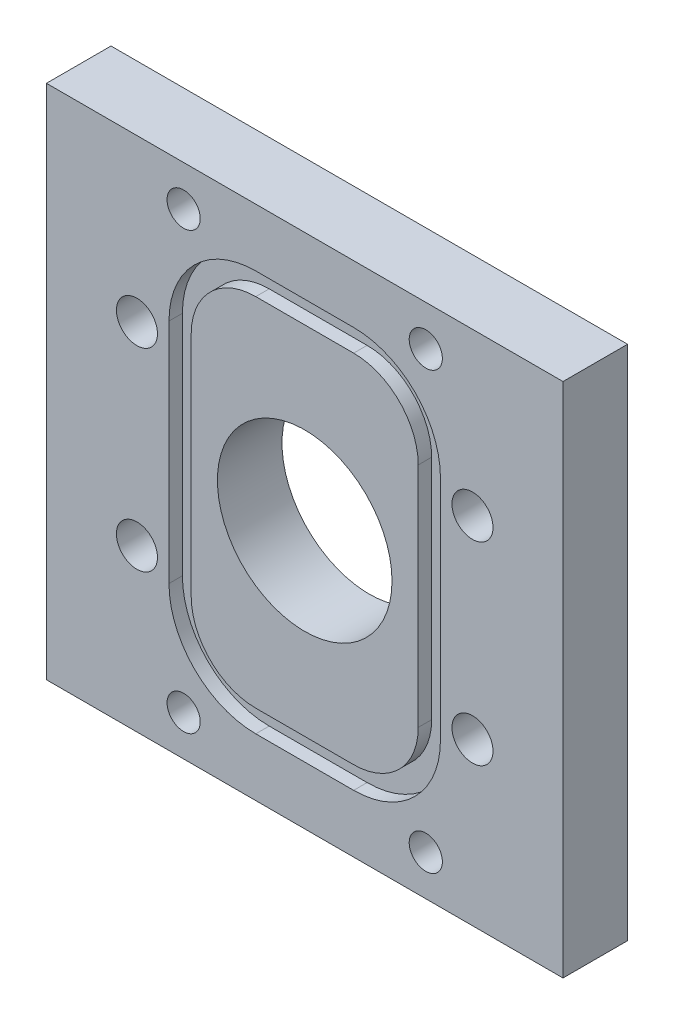
from build123d import *

# Parameters (mm, degrees)
SKETCH1_W                                         = 50.8
SKETCH1_H                                         = 50.8
BOSS_EXTRUDE1_DEPTH                               = 6.35
SKETCH2_R                                         = 8.5852
CUT_EXTRUDE1_DEPTH                                = 37.477972806
CUT_EXTRUDE2_DASH_027_DEPTH                       = 1.3208
CSK_FOR_4_FLAT_HEAD_MACHINE_SCREW_100_D           = 3.2639
CSK_FOR_4_FLAT_HEAD_MACHINE_SCREW_100_CSINK_D     = 5.715
CSK_FOR_4_FLAT_HEAD_MACHINE_SCREW_100_CSINK_ANGLE = 100
F_10_32_TAPPED_HOLE1_AT_2_COUNT                   = 2
F_10_32_TAPPED_HOLE1_AT_2_PITCH                   = 19.05


with BuildPart() as part:
    # Sketch1 → Boss-Extrude1 (new body)
    with BuildSketch(Plane.XY):
        Rectangle(SKETCH1_W, SKETCH1_H)
    extrude(amount=BOSS_EXTRUDE1_DEPTH)

    # Sketch2 → Cut-Extrude1 (cut, through all)
    with BuildSketch(Plane.XY.offset(6.35)):
        Circle(SKETCH2_R)
    extrude(amount=-CUT_EXTRUDE1_DEPTH, mode=Mode.SUBTRACT)

    # Sketch3 → Cut-Extrude2 - dash 027 (cut)
    with BuildSketch(Plane.XY.offset(6.35)):
        with BuildLine():
            Line((13.3477, -11.176), (13.3477, 11.176))
            ThreePointArc((13.3477, 11.176), (10.848032113, 17.210732113), (4.8133, 19.7104))
            Line((4.8133, 19.7104), (-4.8133, 19.7104))
            ThreePointArc((-4.8133, 19.7104), (-10.848032113, 17.210732113), (-13.3477, 11.176))
            Line((-13.3477, 11.176), (-13.3477, -11.176))
            ThreePointArc((-13.3477, -11.176), (-10.848032113, -17.210732113), (-4.8133, -19.7104))
            Line((-4.8133, -19.7104), (4.8133, -19.7104))
            ThreePointArc((4.8133, -19.7104), (10.848032113, -17.210732113), (13.3477, -11.176))
        make_face()
        with BuildLine():
            Line((-4.8133, -17.526), (4.8133, -17.526))
            ThreePointArc((4.8133, -17.526), (9.303428061, -15.666128061), (11.1633, -11.176))
            Line((11.1633, -11.176), (11.1633, 11.176))
            ThreePointArc((11.1633, 11.176), (9.303428061, 15.666128061), (4.8133, 17.526))
            Line((4.8133, 17.526), (-4.8133, 17.526))
            ThreePointArc((-4.8133, 17.526), (-9.303428061, 15.666128061), (-11.1633, 11.176))
            Line((-11.1633, 11.176), (-11.1633, -11.176))
            ThreePointArc((-11.1633, -11.176), (-9.303428061, -15.666128061), (-4.8133, -17.526))
        make_face(mode=Mode.SUBTRACT)
    extrude(amount=-CUT_EXTRUDE2_DASH_027_DEPTH, mode=Mode.SUBTRACT)

    # CSK for #4 Flat Head Machine Screw (100)1 (through all)
    with Locations(Plane(origin=(0, 0, 0), x_dir=(-1, 0, 0), z_dir=(0, 0, -1))):
        with Locations((-11.90625, 21.43125), (11.90625, 21.43125), (-11.90625, -21.43125), (11.90625, -21.43125)):
            CounterSinkHole(CSK_FOR_4_FLAT_HEAD_MACHINE_SCREW_100_D / 2, CSK_FOR_4_FLAT_HEAD_MACHINE_SCREW_100_CSINK_D / 2, counter_sink_angle=CSK_FOR_4_FLAT_HEAD_MACHINE_SCREW_100_CSINK_ANGLE)

    # Sketch8 → #10-32 Tapped Hole1 (revolve, cut)
    with BuildSketch(Plane(origin=(-16.497783942, 9.525, 0), x_dir=(0, 1, 0), z_dir=(1, 0, 0))):
        Polygon((0, 0), (0, 14.929317848), (2.0193, 13.716), (2.0193, 0), align=None)
    f_10_32_tapped_hole1 = revolve(axis=Axis((-16.497783942, 9.525, -6.35), (0, 0, 1)), mode=Mode.SUBTRACT)

    # #10-32 Tapped Hole1 at 2: #10-32 Tapped Hole1 ×2
    with Locations(*[(0, -i * F_10_32_TAPPED_HOLE1_AT_2_PITCH, 0) for i in range(1, F_10_32_TAPPED_HOLE1_AT_2_COUNT)]):
        add(f_10_32_tapped_hole1, mode=Mode.SUBTRACT)

    # Mirror1: #10-32 Tapped Hole1 across plane
    add(f_10_32_tapped_hole1.mirror(Plane(origin=(0, 0, 0), x_dir=(0, 0, 1), z_dir=(1, 0, 0))), mode=Mode.SUBTRACT)

    # Mirror1 copy 1 sketch → Mirror1 copy 1 (revolve, cut)
    with BuildSketch(Plane(origin=(16.497783942, -9.525, 0), x_dir=(0, 1, 0), z_dir=(-1, 0, 0))):
        Polygon((0, 0), (0, -14.929317848), (2.0193, -13.716), (2.0193, 0), align=None)
    revolve(axis=Axis((16.497783942, -9.525, -6.35), (0, 0, -1)), mode=Mode.SUBTRACT)


solid = part.part
